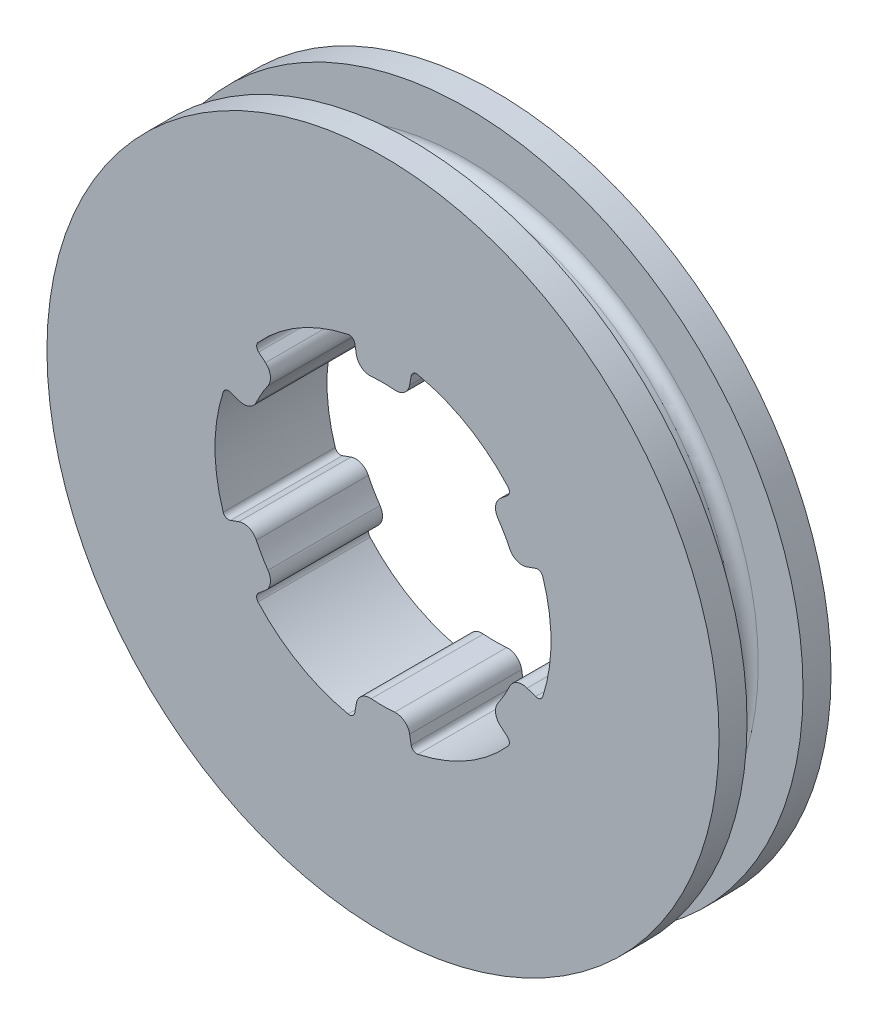
from build123d import *

# Parameters (mm, degrees)
SKETCH1_R                = 60
SKETCH1_R_2              = 30
BOSS_EXTRUDE1_DEPTH      = 10
SKETCH2_W                = 10
SKETCH2_H                = 20
BOSS_EXTRUDE2_START      = -20
BOSS_EXTRUDE2_DEPTH      = 20
FILLET1_R                = 2.5
FILLET2_R                = 1
CIRPATTERN1_COUNT        = 6
FILLET1_OF_CIRPATTERN1_R = 2.5
FILLET2_OF_CIRPATTERN1_R = 1
FILLET3_R                = 2


with BuildPart() as part:
    # Sketch1 → Boss-Extrude1 (new, symmetric)
    with BuildSketch(Plane.XY):
        Circle(SKETCH1_R)
        Circle(SKETCH1_R_2, mode=Mode.SUBTRACT)
    extrude(amount=BOSS_EXTRUDE1_DEPTH, both=True)

    # Sketch2 → Cut-Revolve1 (revolve, cut)
    with BuildSketch(Plane(origin=(0, 0, 0), x_dir=(0, 0, -1), z_dir=(1, 0, 0)), mode=Mode.PRIVATE) as cut_revolve1_sk:
        with Locations((0, 60)):
            Rectangle(SKETCH2_W, SKETCH2_H)
    revolve(cut_revolve1_sk.sketch.rotate(Axis((0, 0, 1000), (0, 0, -1)), 90), axis=Axis((0, 0, 1000), (0, 0, -1)), mode=Mode.SUBTRACT)

    # Sketch3 → Boss-Extrude2 (add)
    with BuildSketch(Plane.XY.offset(10).offset(BOSS_EXTRUDE2_START)):
        with BuildLine():
            Line((5.20944533, 29.54423259), (4.341204442, 24.620193825))
            ThreePointArc((4.341204442, 24.620193825), (0, 25), (-4.341204442, 24.620193825))
            Line((-4.341204442, 24.620193825), (-5.20944533, 29.54423259))
            ThreePointArc((-5.20944533, 29.54423259), (0, 30), (5.20944533, 29.54423259))
        make_face()
    boss_extrude2 = extrude(amount=BOSS_EXTRUDE2_DEPTH)

    # Fillet1
    fillet1_edges = [part.edges().sort_by_distance(p)[0] for p in [
        (4.341204442, 24.620193825, 0),
        (-4.341204442, 24.620193825, 0),
    ]]
    fillet(fillet1_edges, radius=FILLET1_R)

    # Fillet2
    fillet2_edges = [part.edges().sort_by_distance(p)[0] for p in [
        (-5.20944533, 29.54423259, 0),
        (5.20944533, 29.54423259, 0),
    ]]
    fillet(fillet2_edges, radius=FILLET2_R)

    # CirPattern1: Boss-Extrude2 ×6 about axis
    cirpattern1_axis = Axis((0, 0, 0), (0, 0, 1))
    for i in range(1, CIRPATTERN1_COUNT):
        add(boss_extrude2.rotate(cirpattern1_axis, i * 360 / CIRPATTERN1_COUNT))

    # Fillet1 of CirPattern1
    fillet1_of_cirpattern1_edges = [part.edges().sort_by_distance(p)[0] for p in [
        (-19.151111078, 16.069690242, 0),
        (-23.49231552, 8.550503583, 0),
        (-23.49231552, -8.550503583, 0),
        (-19.151111078, -16.069690242, 0),
        (-4.341204442, -24.620193825, 0),
        (4.341204442, -24.620193825, 0),
        (19.151111078, -16.069690242, 0),
        (23.49231552, -8.550503583, 0),
        (23.49231552, 8.550503583, 0),
        (19.151111078, 16.069690242, 0),
    ]]
    fillet(fillet1_of_cirpattern1_edges, radius=FILLET1_OF_CIRPATTERN1_R)

    # Fillet2 of CirPattern1
    fillet2_of_cirpattern1_edges = [part.edges().sort_by_distance(p)[0] for p in [
        (-28.190778624, 10.2606043, 0),
        (-22.981333294, 19.283628291, 0),
        (-22.981333294, -19.283628291, 0),
        (-28.190778624, -10.2606043, 0),
        (5.20944533, -29.54423259, 0),
        (-5.20944533, -29.54423259, 0),
        (28.190778624, -10.2606043, 0),
        (22.981333294, -19.283628291, 0),
        (22.981333294, 19.283628291, 0),
        (28.190778624, 10.2606043, 0),
    ]]
    fillet(fillet2_of_cirpattern1_edges, radius=FILLET2_OF_CIRPATTERN1_R)

    # Fillet3
    fillet3_edges = [part.edges().sort_by_distance(p)[0] for p in [
        (-50, 0, -5),
        (-50, 0, 5),
    ]]
    fillet(fillet3_edges, radius=FILLET3_R)


solid = part.part
